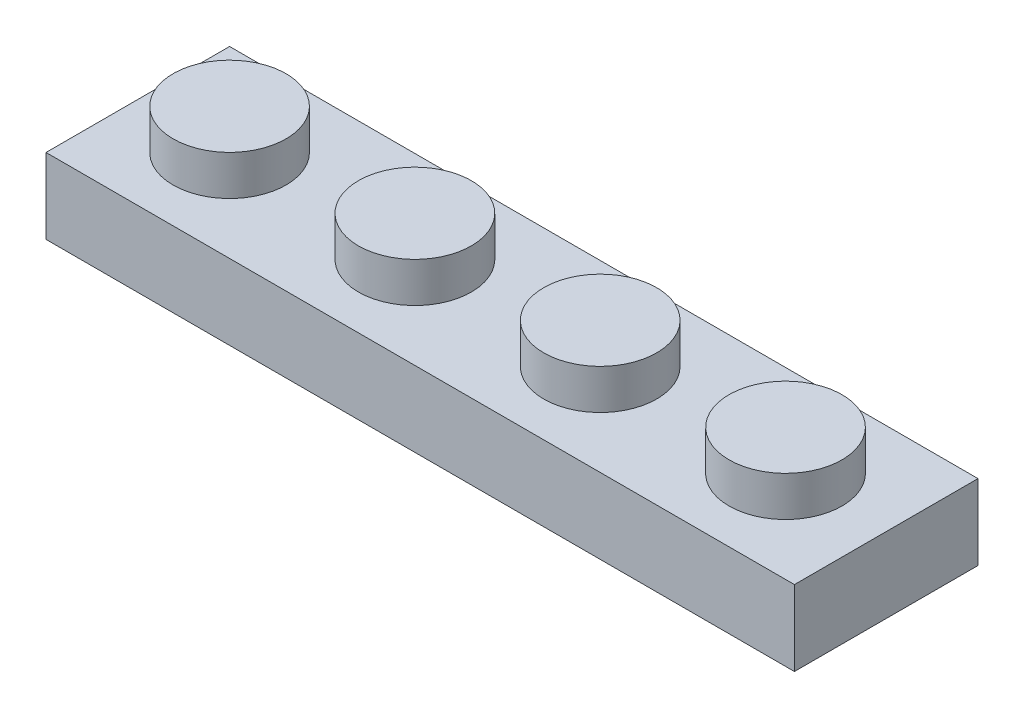
from build123d import *

# Parameters (mm, degrees)
SKETCH_1_W          = 31.8
SKETCH_1_H          = 7.8
EXTRUDE_1_DEPTH     = 3.2
SKETCH_2_R          = 2.4
EXTRUDE_2_DEPTH     = 1.7
SKETCH_3_R          = 2.5
CUT_EXTRUDE_1_DEPTH = 1.8


with BuildPart() as part:
    # Эскиз1 → Бобышка-Вытянуть1 (new body)
    with BuildSketch(Plane(origin=(0, 0, 0), x_dir=(1, 0, 0), z_dir=(0, 1, 0))):
        Rectangle(SKETCH_1_W, SKETCH_1_H)
    extrude(amount=EXTRUDE_1_DEPTH)

    # Эскиз2 → Бобышка-Вытянуть2 (add)
    with BuildSketch(Plane(origin=(0, 3.2, 0), x_dir=(1, 0, 0), z_dir=(0, 1, 0))):
        with Locations(Location((-12, 0, 0), (0, 0, 270))):
            Circle(SKETCH_2_R)
        with Locations(Location((-4.126, 0, 0), (0, 0, 270))):
            Circle(SKETCH_2_R)
        with Locations(Location((3.748, 0, 0), (0, 0, 270))):
            Circle(SKETCH_2_R)
        with Locations(Location((11.622, 0, 0), (0, 0, 270))):
            Circle(SKETCH_2_R)
    extrude(amount=EXTRUDE_2_DEPTH)

    # Эскиз3 → Вырез-Вытянуть1 (cut)
    with BuildSketch(Plane.XZ):
        with Locations(Location((-12, 0, 0), (0, 0, 270))):
            Circle(SKETCH_3_R)
        with Locations(Location((-4.126, 0, 0), (0, 0, 270))):
            Circle(SKETCH_3_R)
        with Locations(Location((3.748, 0, 0), (0, 0, 270))):
            Circle(SKETCH_3_R)
        with Locations(Location((11.622, 0, 0), (0, 0, 270))):
            Circle(SKETCH_3_R)
    extrude(amount=-CUT_EXTRUDE_1_DEPTH, mode=Mode.SUBTRACT)


solid = part.part
